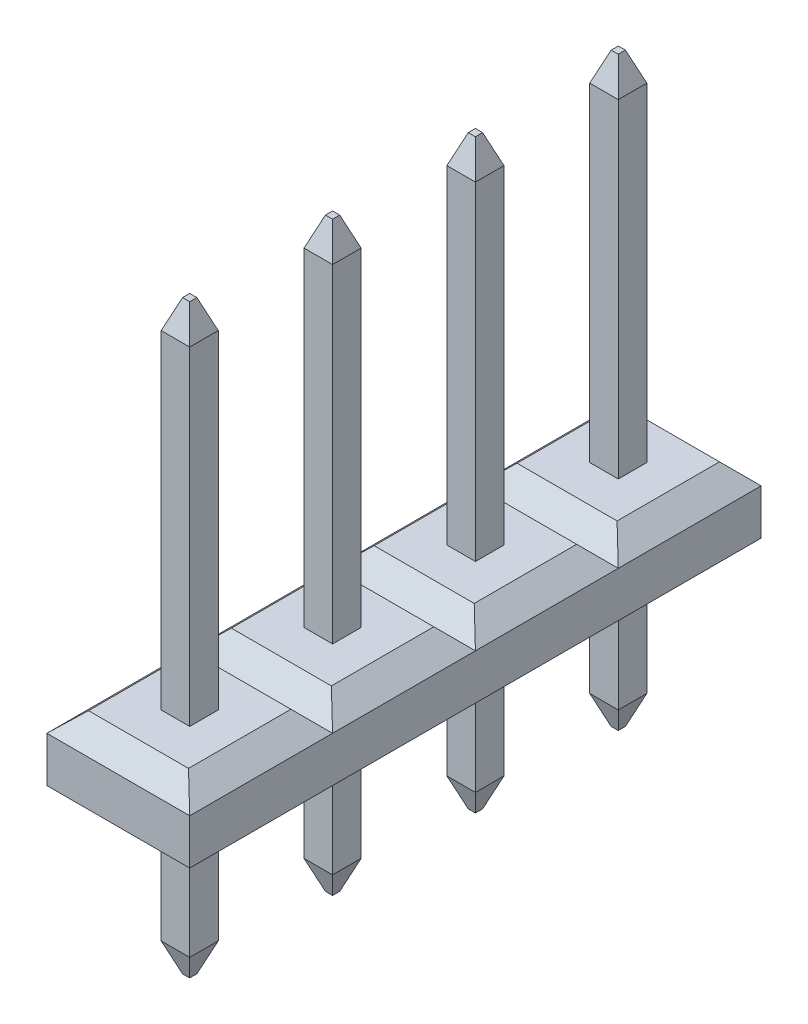
from build123d import *
from OCP.BRepFilletAPI import BRepFilletAPI_MakeChamfer

# Parameters (mm, degrees)
SKETCH1_W                   = 2.54
SKETCH1_H                   = 2.54
BOSS_EXTRUDE1_DEPTH         = 1.524
SKETCH2_W                   = 0.508
SKETCH2_H                   = 0.508
BOSS_EXTRUDE2_DEPTH         = 6.35
SKETCH3_W                   = 0.508
SKETCH3_H                   = 0.508
BOSS_EXTRUDE3_DEPTH         = 2.54
CHAMFER1_SIZE               = 0.508
CHAMFER1_SIZE2              = 0.1905
CHAMFER2_SIZE               = 0.508
CHAMFER2_SIZE2              = 0.1905
CUT_EXTRUDE1_DEPTH          = 2.54
CUT_EXTRUDE2_DEPTH          = 2.54
LPATTERN5_COUNT             = 4
LPATTERN5_PITCH             = 2.54
CHAMFER1_OF_LPATTERN5_SIZE  = 0.508
CHAMFER1_OF_LPATTERN5_SIZE2 = 0.1905
CHAMFER2_OF_LPATTERN5_SIZE  = 0.508
CHAMFER2_OF_LPATTERN5_SIZE2 = 0.1905


with BuildPart() as part:
    # Sketch1 → Boss-Extrude1 (new body)
    with BuildSketch(Plane(origin=(0, 0, 0), x_dir=(1, 0, 0), z_dir=(0, 1, 0))):
        with Locations((1.27, 1.27)):
            Rectangle(SKETCH1_W, SKETCH1_H)
    boss_extrude1 = extrude(amount=BOSS_EXTRUDE1_DEPTH)

    # Sketch2 → Boss-Extrude2 (add)
    with BuildSketch(Plane(origin=(0, 1.524, 0), x_dir=(1, 0, 0), z_dir=(0, 1, 0))):
        with Locations((1.27, 1.27)):
            Rectangle(SKETCH2_W, SKETCH2_H)
    boss_extrude2 = extrude(amount=BOSS_EXTRUDE2_DEPTH)

    # Sketch3 → Boss-Extrude3 (add)
    with BuildSketch(Plane.XZ):
        with Locations((1.27, -1.27)):
            Rectangle(SKETCH3_W, SKETCH3_H)
    boss_extrude3 = extrude(amount=BOSS_EXTRUDE3_DEPTH)

    # Chamfer1: one chamfer whose edges measure the first distance from different faces: ONE call of the kernel's chamfer builder (chamfer() names one face for all edges)
    chamfer1_edges_1 = [part.edges().sort_by_distance(p)[0] for p in [
        (1.016, 7.874, -1.27),
    ]]
    chamfer1_side_1 = [part.faces().sort_by_distance(p)[0] for p in [
        (1.016, 4.699, -1.27),
    ]]
    chamfer1_edges_2 = [part.edges().sort_by_distance(p)[0] for p in [
        (1.27, 7.874, -1.016),
    ]]
    chamfer1_side_2 = [part.faces().sort_by_distance(p)[0] for p in [
        (1.27, 4.699, -1.016),
    ]]
    chamfer1_edges_3 = [part.edges().sort_by_distance(p)[0] for p in [
        (1.524, 7.874, -1.27),
    ]]
    chamfer1_side_3 = [part.faces().sort_by_distance(p)[0] for p in [
        (1.524, 4.699, -1.27),
    ]]
    chamfer1_edges_4 = [part.edges().sort_by_distance(p)[0] for p in [
        (1.27, 7.874, -1.524),
    ]]
    chamfer1_side_4 = [part.faces().sort_by_distance(p)[0] for p in [
        (1.27, 4.699, -1.524),
    ]]
    chamfer1 = BRepFilletAPI_MakeChamfer(part.part.solid().wrapped)
    for e in chamfer1_edges_1:
        chamfer1.Add(CHAMFER1_SIZE, CHAMFER1_SIZE2, e.wrapped, chamfer1_side_1[0].wrapped)  # the first distance lies on this face
    for e in chamfer1_edges_2:
        chamfer1.Add(CHAMFER1_SIZE, CHAMFER1_SIZE2, e.wrapped, chamfer1_side_2[0].wrapped)  # the first distance lies on this face
    for e in chamfer1_edges_3:
        chamfer1.Add(CHAMFER1_SIZE, CHAMFER1_SIZE2, e.wrapped, chamfer1_side_3[0].wrapped)  # the first distance lies on this face
    for e in chamfer1_edges_4:
        chamfer1.Add(CHAMFER1_SIZE, CHAMFER1_SIZE2, e.wrapped, chamfer1_side_4[0].wrapped)  # the first distance lies on this face
    add(Compound.cast(chamfer1.Shape()), mode=Mode.REPLACE)

    # Chamfer2: one chamfer whose edges measure the first distance from different faces: ONE call of the kernel's chamfer builder (chamfer() names one face for all edges)
    chamfer2_edges_1 = [part.edges().sort_by_distance(p)[0] for p in [
        (1.27, -2.54, -1.524),
    ]]
    chamfer2_side_1 = [part.faces().sort_by_distance(p)[0] for p in [
        (1.27, -1.27, -1.524),
    ]]
    chamfer2_edges_2 = [part.edges().sort_by_distance(p)[0] for p in [
        (1.524, -2.54, -1.27),
    ]]
    chamfer2_side_2 = [part.faces().sort_by_distance(p)[0] for p in [
        (1.524, -1.27, -1.27),
    ]]
    chamfer2_edges_3 = [part.edges().sort_by_distance(p)[0] for p in [
        (1.27, -2.54, -1.016),
    ]]
    chamfer2_side_3 = [part.faces().sort_by_distance(p)[0] for p in [
        (1.27, -1.27, -1.016),
    ]]
    chamfer2_edges_4 = [part.edges().sort_by_distance(p)[0] for p in [
        (1.016, -2.54, -1.27),
    ]]
    chamfer2_side_4 = [part.faces().sort_by_distance(p)[0] for p in [
        (1.016, -1.27, -1.27),
    ]]
    chamfer2 = BRepFilletAPI_MakeChamfer(part.part.solid().wrapped)
    for e in chamfer2_edges_1:
        chamfer2.Add(CHAMFER2_SIZE, CHAMFER2_SIZE2, e.wrapped, chamfer2_side_1[0].wrapped)  # the first distance lies on this face
    for e in chamfer2_edges_2:
        chamfer2.Add(CHAMFER2_SIZE, CHAMFER2_SIZE2, e.wrapped, chamfer2_side_2[0].wrapped)  # the first distance lies on this face
    for e in chamfer2_edges_3:
        chamfer2.Add(CHAMFER2_SIZE, CHAMFER2_SIZE2, e.wrapped, chamfer2_side_3[0].wrapped)  # the first distance lies on this face
    for e in chamfer2_edges_4:
        chamfer2.Add(CHAMFER2_SIZE, CHAMFER2_SIZE2, e.wrapped, chamfer2_side_4[0].wrapped)  # the first distance lies on this face
    add(Compound.cast(chamfer2.Shape()), mode=Mode.REPLACE)

    # Sketch4 → Cut-Extrude1 (cut)
    with BuildSketch(Plane(origin=(0, 0, -2.54), x_dir=(-1, 0, 0), z_dir=(0, 0, -1))):
        Polygon((-2.54, 1.16453539), (-2.159, 1.524), (-2.54, 1.524), align=None)
        Polygon((0, 1.524), (0, 1.16453539), (-0.381, 1.524), align=None)
        Polygon((0, 0.35946461), (-0.381, 0), (0, 0), align=None)
        Polygon((-2.54, 0), (-2.54, 0.35946461), (-2.159, 0), align=None)
    cut_extrude1 = extrude(amount=-CUT_EXTRUDE1_DEPTH, mode=Mode.SUBTRACT)

    # Sketch5 → Cut-Extrude2 (cut)
    with BuildSketch(Plane.ZY):
        Polygon((-2.54, 1.16453539), (-2.159, 1.54553539), (-2.54, 1.54553539), align=None)
        Polygon((0, 1.54553539), (0, 1.16453539), (-0.381, 1.54553539), align=None)
        Polygon((-2.54, -0.02153539), (-2.54, 0.35946461), (-2.159, -0.02153539), align=None)
        Polygon((0, 0.35946461), (-0.381, -0.02153539), (0, -0.02153539), align=None)
    cut_extrude2 = extrude(amount=-CUT_EXTRUDE2_DEPTH, mode=Mode.SUBTRACT)

    # LPattern5: Boss-Extrude1, Boss-Extrude2, Boss-Extrude3, Cut-Extrude1, Cut-Extrude2 ×4
    with Locations(*[(0, 0, i * LPATTERN5_PITCH) for i in range(1, LPATTERN5_COUNT)]):
        add(boss_extrude1)
        add(boss_extrude2)
        add(boss_extrude3)
        add(cut_extrude1, mode=Mode.SUBTRACT)
        add(cut_extrude2, mode=Mode.SUBTRACT)

    # Chamfer1 of LPattern5: one chamfer whose edges measure the first distance from different faces: ONE call of the kernel's chamfer builder (chamfer() names one face for all edges)
    chamfer1_of_lpattern5_edges_1 = [part.edges().sort_by_distance(p)[0] for p in [
        (1.016, 7.874, 1.27),
    ]]
    chamfer1_of_lpattern5_side_1 = [part.faces().sort_by_distance(p)[0] for p in [
        (1.016, 4.699, 1.27),
    ]]
    chamfer1_of_lpattern5_edges_2 = [part.edges().sort_by_distance(p)[0] for p in [
        (1.27, 7.874, 1.524),
    ]]
    chamfer1_of_lpattern5_side_2 = [part.faces().sort_by_distance(p)[0] for p in [
        (1.27, 4.699, 1.524),
    ]]
    chamfer1_of_lpattern5_edges_3 = [part.edges().sort_by_distance(p)[0] for p in [
        (1.524, 7.874, 1.27),
    ]]
    chamfer1_of_lpattern5_side_3 = [part.faces().sort_by_distance(p)[0] for p in [
        (1.524, 4.699, 1.27),
    ]]
    chamfer1_of_lpattern5_edges_4 = [part.edges().sort_by_distance(p)[0] for p in [
        (1.27, 7.874, 1.016),
    ]]
    chamfer1_of_lpattern5_side_4 = [part.faces().sort_by_distance(p)[0] for p in [
        (1.27, 4.699, 1.016),
    ]]
    chamfer1_of_lpattern5_edges_5 = [part.edges().sort_by_distance(p)[0] for p in [
        (1.016, 7.874, 3.81),
    ]]
    chamfer1_of_lpattern5_side_5 = [part.faces().sort_by_distance(p)[0] for p in [
        (1.016, 4.699, 3.81),
    ]]
    chamfer1_of_lpattern5_edges_6 = [part.edges().sort_by_distance(p)[0] for p in [
        (1.27, 7.874, 4.064),
    ]]
    chamfer1_of_lpattern5_side_6 = [part.faces().sort_by_distance(p)[0] for p in [
        (1.27, 4.699, 4.064),
    ]]
    chamfer1_of_lpattern5_edges_7 = [part.edges().sort_by_distance(p)[0] for p in [
        (1.524, 7.874, 3.81),
    ]]
    chamfer1_of_lpattern5_side_7 = [part.faces().sort_by_distance(p)[0] for p in [
        (1.524, 4.699, 3.81),
    ]]
    chamfer1_of_lpattern5_edges_8 = [part.edges().sort_by_distance(p)[0] for p in [
        (1.27, 7.874, 3.556),
    ]]
    chamfer1_of_lpattern5_side_8 = [part.faces().sort_by_distance(p)[0] for p in [
        (1.27, 4.699, 3.556),
    ]]
    chamfer1_of_lpattern5_edges_9 = [part.edges().sort_by_distance(p)[0] for p in [
        (1.016, 7.874, 6.35),
    ]]
    chamfer1_of_lpattern5_side_9 = [part.faces().sort_by_distance(p)[0] for p in [
        (1.016, 4.699, 6.35),
    ]]
    chamfer1_of_lpattern5_edges_10 = [part.edges().sort_by_distance(p)[0] for p in [
        (1.27, 7.874, 6.604),
    ]]
    chamfer1_of_lpattern5_side_10 = [part.faces().sort_by_distance(p)[0] for p in [
        (1.27, 4.699, 6.604),
    ]]
    chamfer1_of_lpattern5_edges_11 = [part.edges().sort_by_distance(p)[0] for p in [
        (1.524, 7.874, 6.35),
    ]]
    chamfer1_of_lpattern5_side_11 = [part.faces().sort_by_distance(p)[0] for p in [
        (1.524, 4.699, 6.35),
    ]]
    chamfer1_of_lpattern5_edges_12 = [part.edges().sort_by_distance(p)[0] for p in [
        (1.27, 7.874, 6.096),
    ]]
    chamfer1_of_lpattern5_side_12 = [part.faces().sort_by_distance(p)[0] for p in [
        (1.27, 4.699, 6.096),
    ]]
    chamfer1_of_lpattern5 = BRepFilletAPI_MakeChamfer(part.part.solid().wrapped)
    for e in chamfer1_of_lpattern5_edges_1:
        chamfer1_of_lpattern5.Add(CHAMFER1_OF_LPATTERN5_SIZE, CHAMFER1_OF_LPATTERN5_SIZE2, e.wrapped, chamfer1_of_lpattern5_side_1[0].wrapped)  # the first distance lies on this face
    for e in chamfer1_of_lpattern5_edges_2:
        chamfer1_of_lpattern5.Add(CHAMFER1_OF_LPATTERN5_SIZE, CHAMFER1_OF_LPATTERN5_SIZE2, e.wrapped, chamfer1_of_lpattern5_side_2[0].wrapped)  # the first distance lies on this face
    for e in chamfer1_of_lpattern5_edges_3:
        chamfer1_of_lpattern5.Add(CHAMFER1_OF_LPATTERN5_SIZE, CHAMFER1_OF_LPATTERN5_SIZE2, e.wrapped, chamfer1_of_lpattern5_side_3[0].wrapped)  # the first distance lies on this face
    for e in chamfer1_of_lpattern5_edges_4:
        chamfer1_of_lpattern5.Add(CHAMFER1_OF_LPATTERN5_SIZE, CHAMFER1_OF_LPATTERN5_SIZE2, e.wrapped, chamfer1_of_lpattern5_side_4[0].wrapped)  # the first distance lies on this face
    for e in chamfer1_of_lpattern5_edges_5:
        chamfer1_of_lpattern5.Add(CHAMFER1_OF_LPATTERN5_SIZE, CHAMFER1_OF_LPATTERN5_SIZE2, e.wrapped, chamfer1_of_lpattern5_side_5[0].wrapped)  # the first distance lies on this face
    for e in chamfer1_of_lpattern5_edges_6:
        chamfer1_of_lpattern5.Add(CHAMFER1_OF_LPATTERN5_SIZE, CHAMFER1_OF_LPATTERN5_SIZE2, e.wrapped, chamfer1_of_lpattern5_side_6[0].wrapped)  # the first distance lies on this face
    for e in chamfer1_of_lpattern5_edges_7:
        chamfer1_of_lpattern5.Add(CHAMFER1_OF_LPATTERN5_SIZE, CHAMFER1_OF_LPATTERN5_SIZE2, e.wrapped, chamfer1_of_lpattern5_side_7[0].wrapped)  # the first distance lies on this face
    for e in chamfer1_of_lpattern5_edges_8:
        chamfer1_of_lpattern5.Add(CHAMFER1_OF_LPATTERN5_SIZE, CHAMFER1_OF_LPATTERN5_SIZE2, e.wrapped, chamfer1_of_lpattern5_side_8[0].wrapped)  # the first distance lies on this face
    for e in chamfer1_of_lpattern5_edges_9:
        chamfer1_of_lpattern5.Add(CHAMFER1_OF_LPATTERN5_SIZE, CHAMFER1_OF_LPATTERN5_SIZE2, e.wrapped, chamfer1_of_lpattern5_side_9[0].wrapped)  # the first distance lies on this face
    for e in chamfer1_of_lpattern5_edges_10:
        chamfer1_of_lpattern5.Add(CHAMFER1_OF_LPATTERN5_SIZE, CHAMFER1_OF_LPATTERN5_SIZE2, e.wrapped, chamfer1_of_lpattern5_side_10[0].wrapped)  # the first distance lies on this face
    for e in chamfer1_of_lpattern5_edges_11:
        chamfer1_of_lpattern5.Add(CHAMFER1_OF_LPATTERN5_SIZE, CHAMFER1_OF_LPATTERN5_SIZE2, e.wrapped, chamfer1_of_lpattern5_side_11[0].wrapped)  # the first distance lies on this face
    for e in chamfer1_of_lpattern5_edges_12:
        chamfer1_of_lpattern5.Add(CHAMFER1_OF_LPATTERN5_SIZE, CHAMFER1_OF_LPATTERN5_SIZE2, e.wrapped, chamfer1_of_lpattern5_side_12[0].wrapped)  # the first distance lies on this face
    add(Compound.cast(chamfer1_of_lpattern5.Shape()), mode=Mode.REPLACE)

    # Chamfer2 of LPattern5: one chamfer whose edges measure the first distance from different faces: ONE call of the kernel's chamfer builder (chamfer() names one face for all edges)
    chamfer2_of_lpattern5_edges_1 = [part.edges().sort_by_distance(p)[0] for p in [
        (1.27, -2.54, 1.016),
    ]]
    chamfer2_of_lpattern5_side_1 = [part.faces().sort_by_distance(p)[0] for p in [
        (1.27, -1.27, 1.016),
    ]]
    chamfer2_of_lpattern5_edges_2 = [part.edges().sort_by_distance(p)[0] for p in [
        (1.524, -2.54, 1.27),
    ]]
    chamfer2_of_lpattern5_side_2 = [part.faces().sort_by_distance(p)[0] for p in [
        (1.524, -1.27, 1.27),
    ]]
    chamfer2_of_lpattern5_edges_3 = [part.edges().sort_by_distance(p)[0] for p in [
        (1.27, -2.54, 1.524),
    ]]
    chamfer2_of_lpattern5_side_3 = [part.faces().sort_by_distance(p)[0] for p in [
        (1.27, -1.27, 1.524),
    ]]
    chamfer2_of_lpattern5_edges_4 = [part.edges().sort_by_distance(p)[0] for p in [
        (1.016, -2.54, 1.27),
    ]]
    chamfer2_of_lpattern5_side_4 = [part.faces().sort_by_distance(p)[0] for p in [
        (1.016, -1.27, 1.27),
    ]]
    chamfer2_of_lpattern5_edges_5 = [part.edges().sort_by_distance(p)[0] for p in [
        (1.27, -2.54, 3.556),
    ]]
    chamfer2_of_lpattern5_side_5 = [part.faces().sort_by_distance(p)[0] for p in [
        (1.27, -1.27, 3.556),
    ]]
    chamfer2_of_lpattern5_edges_6 = [part.edges().sort_by_distance(p)[0] for p in [
        (1.524, -2.54, 3.81),
    ]]
    chamfer2_of_lpattern5_side_6 = [part.faces().sort_by_distance(p)[0] for p in [
        (1.524, -1.27, 3.81),
    ]]
    chamfer2_of_lpattern5_edges_7 = [part.edges().sort_by_distance(p)[0] for p in [
        (1.27, -2.54, 4.064),
    ]]
    chamfer2_of_lpattern5_side_7 = [part.faces().sort_by_distance(p)[0] for p in [
        (1.27, -1.27, 4.064),
    ]]
    chamfer2_of_lpattern5_edges_8 = [part.edges().sort_by_distance(p)[0] for p in [
        (1.016, -2.54, 3.81),
    ]]
    chamfer2_of_lpattern5_side_8 = [part.faces().sort_by_distance(p)[0] for p in [
        (1.016, -1.27, 3.81),
    ]]
    chamfer2_of_lpattern5_edges_9 = [part.edges().sort_by_distance(p)[0] for p in [
        (1.27, -2.54, 6.096),
    ]]
    chamfer2_of_lpattern5_side_9 = [part.faces().sort_by_distance(p)[0] for p in [
        (1.27, -1.27, 6.096),
    ]]
    chamfer2_of_lpattern5_edges_10 = [part.edges().sort_by_distance(p)[0] for p in [
        (1.524, -2.54, 6.35),
    ]]
    chamfer2_of_lpattern5_side_10 = [part.faces().sort_by_distance(p)[0] for p in [
        (1.524, -1.27, 6.35),
    ]]
    chamfer2_of_lpattern5_edges_11 = [part.edges().sort_by_distance(p)[0] for p in [
        (1.27, -2.54, 6.604),
    ]]
    chamfer2_of_lpattern5_side_11 = [part.faces().sort_by_distance(p)[0] for p in [
        (1.27, -1.27, 6.604),
    ]]
    chamfer2_of_lpattern5_edges_12 = [part.edges().sort_by_distance(p)[0] for p in [
        (1.016, -2.54, 6.35),
    ]]
    chamfer2_of_lpattern5_side_12 = [part.faces().sort_by_distance(p)[0] for p in [
        (1.016, -1.27, 6.35),
    ]]
    chamfer2_of_lpattern5 = BRepFilletAPI_MakeChamfer(part.part.solid().wrapped)
    for e in chamfer2_of_lpattern5_edges_1:
        chamfer2_of_lpattern5.Add(CHAMFER2_OF_LPATTERN5_SIZE, CHAMFER2_OF_LPATTERN5_SIZE2, e.wrapped, chamfer2_of_lpattern5_side_1[0].wrapped)  # the first distance lies on this face
    for e in chamfer2_of_lpattern5_edges_2:
        chamfer2_of_lpattern5.Add(CHAMFER2_OF_LPATTERN5_SIZE, CHAMFER2_OF_LPATTERN5_SIZE2, e.wrapped, chamfer2_of_lpattern5_side_2[0].wrapped)  # the first distance lies on this face
    for e in chamfer2_of_lpattern5_edges_3:
        chamfer2_of_lpattern5.Add(CHAMFER2_OF_LPATTERN5_SIZE, CHAMFER2_OF_LPATTERN5_SIZE2, e.wrapped, chamfer2_of_lpattern5_side_3[0].wrapped)  # the first distance lies on this face
    for e in chamfer2_of_lpattern5_edges_4:
        chamfer2_of_lpattern5.Add(CHAMFER2_OF_LPATTERN5_SIZE, CHAMFER2_OF_LPATTERN5_SIZE2, e.wrapped, chamfer2_of_lpattern5_side_4[0].wrapped)  # the first distance lies on this face
    for e in chamfer2_of_lpattern5_edges_5:
        chamfer2_of_lpattern5.Add(CHAMFER2_OF_LPATTERN5_SIZE, CHAMFER2_OF_LPATTERN5_SIZE2, e.wrapped, chamfer2_of_lpattern5_side_5[0].wrapped)  # the first distance lies on this face
    for e in chamfer2_of_lpattern5_edges_6:
        chamfer2_of_lpattern5.Add(CHAMFER2_OF_LPATTERN5_SIZE, CHAMFER2_OF_LPATTERN5_SIZE2, e.wrapped, chamfer2_of_lpattern5_side_6[0].wrapped)  # the first distance lies on this face
    for e in chamfer2_of_lpattern5_edges_7:
        chamfer2_of_lpattern5.Add(CHAMFER2_OF_LPATTERN5_SIZE, CHAMFER2_OF_LPATTERN5_SIZE2, e.wrapped, chamfer2_of_lpattern5_side_7[0].wrapped)  # the first distance lies on this face
    for e in chamfer2_of_lpattern5_edges_8:
        chamfer2_of_lpattern5.Add(CHAMFER2_OF_LPATTERN5_SIZE, CHAMFER2_OF_LPATTERN5_SIZE2, e.wrapped, chamfer2_of_lpattern5_side_8[0].wrapped)  # the first distance lies on this face
    for e in chamfer2_of_lpattern5_edges_9:
        chamfer2_of_lpattern5.Add(CHAMFER2_OF_LPATTERN5_SIZE, CHAMFER2_OF_LPATTERN5_SIZE2, e.wrapped, chamfer2_of_lpattern5_side_9[0].wrapped)  # the first distance lies on this face
    for e in chamfer2_of_lpattern5_edges_10:
        chamfer2_of_lpattern5.Add(CHAMFER2_OF_LPATTERN5_SIZE, CHAMFER2_OF_LPATTERN5_SIZE2, e.wrapped, chamfer2_of_lpattern5_side_10[0].wrapped)  # the first distance lies on this face
    for e in chamfer2_of_lpattern5_edges_11:
        chamfer2_of_lpattern5.Add(CHAMFER2_OF_LPATTERN5_SIZE, CHAMFER2_OF_LPATTERN5_SIZE2, e.wrapped, chamfer2_of_lpattern5_side_11[0].wrapped)  # the first distance lies on this face
    for e in chamfer2_of_lpattern5_edges_12:
        chamfer2_of_lpattern5.Add(CHAMFER2_OF_LPATTERN5_SIZE, CHAMFER2_OF_LPATTERN5_SIZE2, e.wrapped, chamfer2_of_lpattern5_side_12[0].wrapped)  # the first distance lies on this face
    add(Compound.cast(chamfer2_of_lpattern5.Shape()), mode=Mode.REPLACE)


solid = part.part
